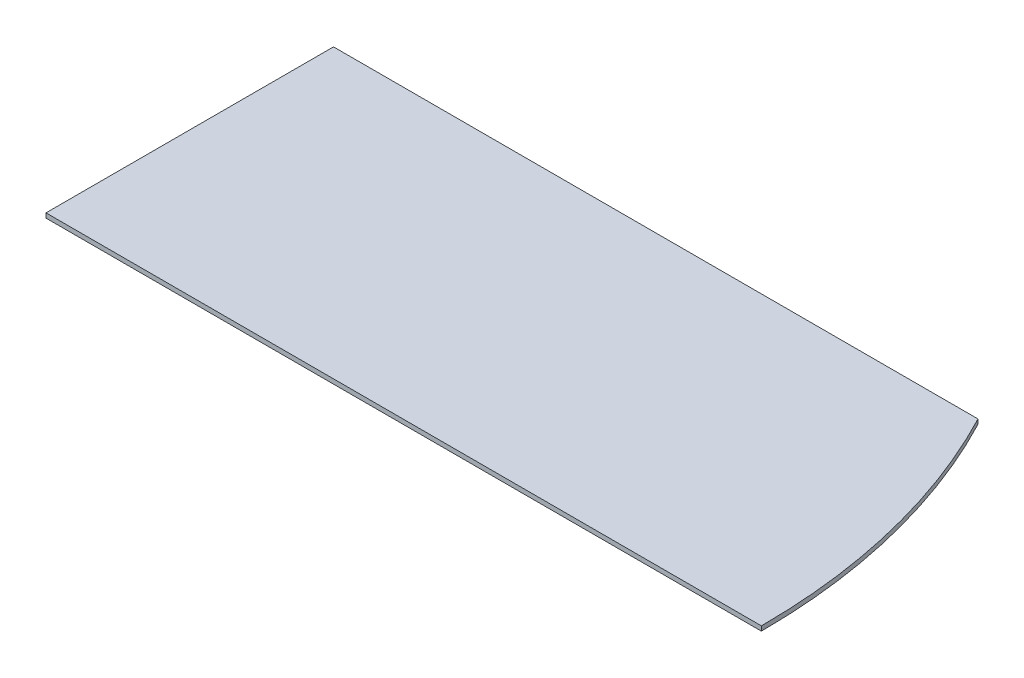
from build123d import *

# Parameters (mm, degrees)
BOSS_EXTRUDE1_DEPTH = 2


with BuildPart() as part:
    # Sketch1 → Boss-Extrude1 (new body)
    with BuildSketch(Plane(origin=(0, 0, 0), x_dir=(1, 0, 0), z_dir=(0, 1, 0))):
        with BuildLine():
            Line((0, 0), (311, 0))
            ThreePointArc((311, 0), (303.184772243, 64.37013864), (280.193198895, 125))
            Line((280.193198895, 125), (0, 125))
            Line((0, 125), (0, 0))
        make_face()
    extrude(amount=BOSS_EXTRUDE1_DEPTH)


solid = part.part
